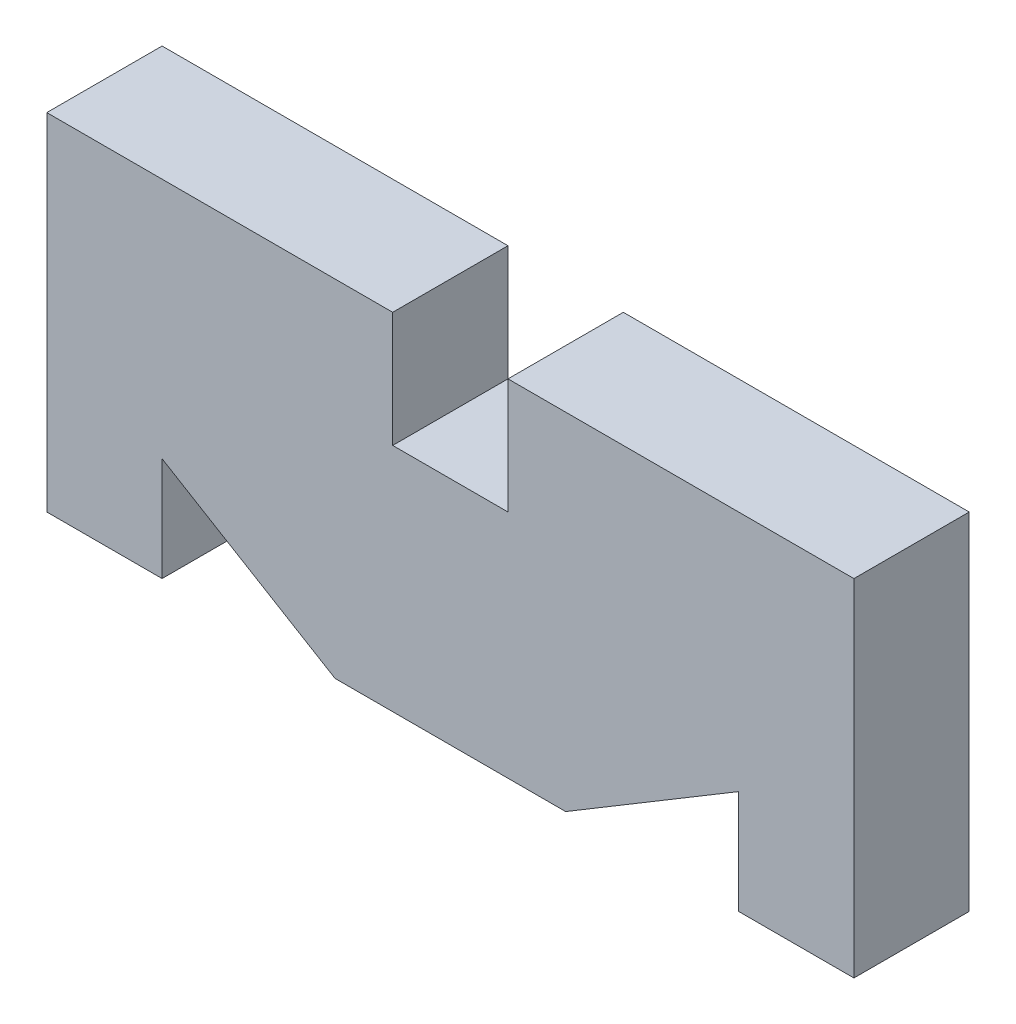
from build123d import *

# Parameters (mm, degrees)
BOSS_EXTRUDE1_DEPTH = 10


with BuildPart() as part:
    # Sketch2 → Boss-Extrude1 (new body)
    with BuildSketch(Plane.XY):
        Polygon((-22.97826087, 22.97826087), (-22.97826087, -7.02173913), (-12.97826087, -7.02173913), (-12.97826087, 1.97826087), (2.02173913, -7.02173913), (22.02173913, -7.02173913), (37.02173913, 1.97826087), (37.02173913, -7.02173913), (47.02173913, -7.02173913), (47.02173913, 22.97826087), (17.02173913, 22.97826087), (17.02173913, 12.97826087), (7.02173913, 12.97826087), (7.02173913, 22.97826087), align=None)
    extrude(amount=BOSS_EXTRUDE1_DEPTH)


solid = part.part
